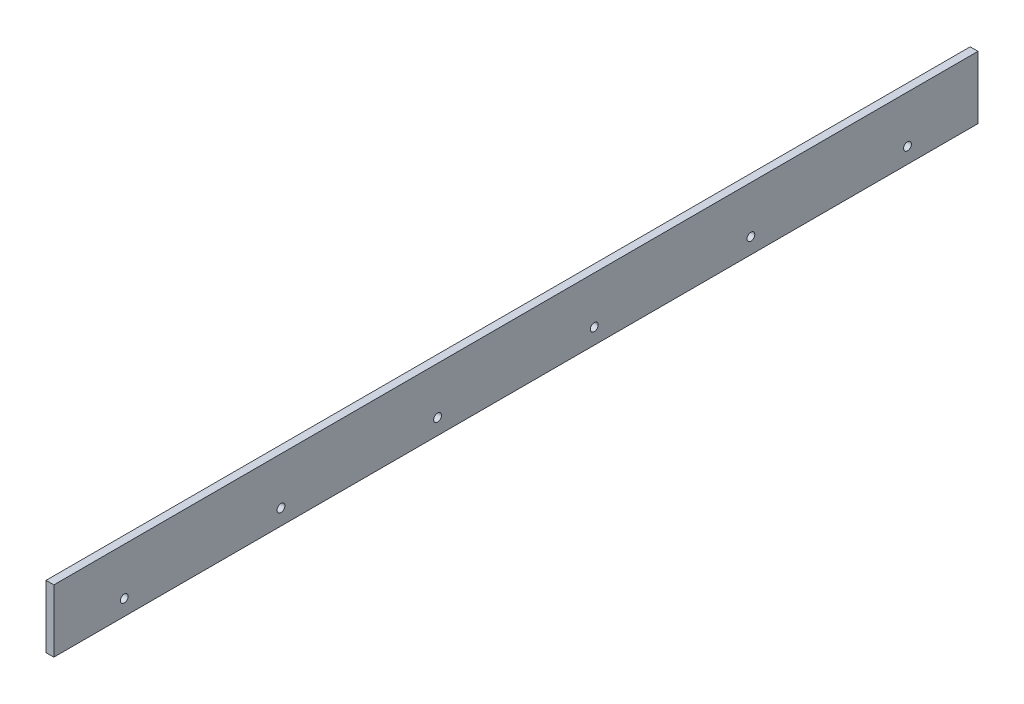
from build123d import *

# Parameters (mm, degrees)
SKETCH_1_W          = 5
SKETCH_1_H          = 40
EXTRUDE_1_DEPTH     = 590
SKETCH_2_R          = 2.5
CUT_EXTRUDE_1_DEPTH = 591.360059625


with BuildPart() as part:
    # 草图1 → 凸台-拉伸1 (new body)
    with BuildSketch(Plane.XY):
        Rectangle(SKETCH_1_W, SKETCH_1_H)
    extrude(amount=EXTRUDE_1_DEPTH)

    # 草图2 → 切除-拉伸1 (cut, through all)
    with BuildSketch(Plane(origin=(2.5, 0, 0), x_dir=(0, 0, -1), z_dir=(1, 0, 0))):
        with Locations(Location((-345, -10, 0), (0, 0, 90))):
            Circle(SKETCH_2_R)
        with Locations(Location((-445, -10, 0), (0, 0, 90))):
            Circle(SKETCH_2_R)
        with Locations(Location((-145, -10, 0), (0, 0, 270))):
            Circle(SKETCH_2_R)
        with Locations(Location((-245, -10, 0), (0, 0, 270))):
            Circle(SKETCH_2_R)
        with Locations(Location((-545, -10, 0), (0, 0, 90))):
            Circle(SKETCH_2_R)
        with Locations(Location((-45, -10, 0), (0, 0, 270))):
            Circle(SKETCH_2_R)
    extrude(amount=-CUT_EXTRUDE_1_DEPTH, mode=Mode.SUBTRACT)


solid = part.part
